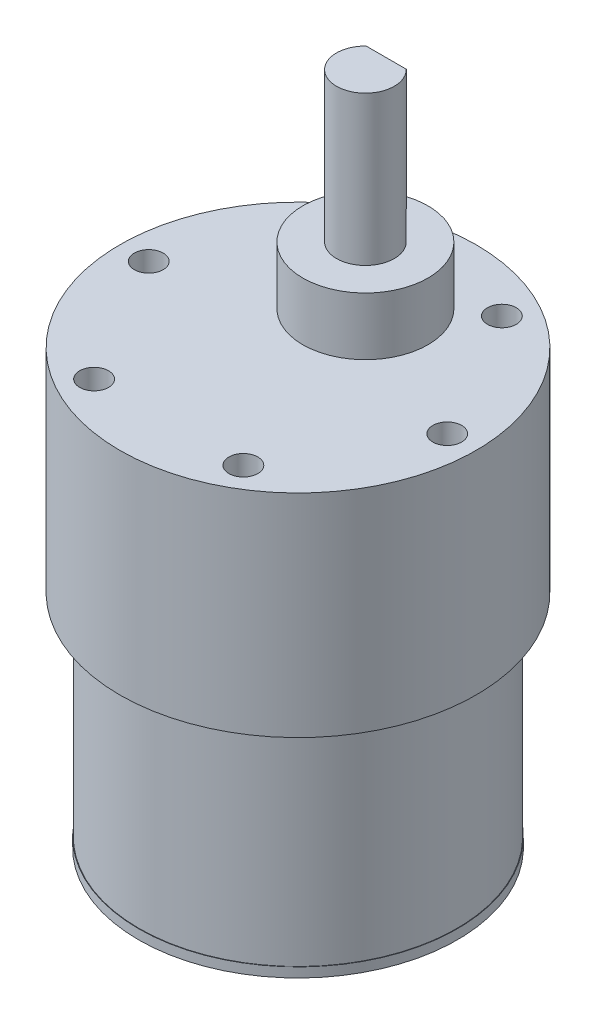
from build123d import *

# Parameters (mm, degrees)
SKETCH1_R           = 18.5
BOSS_EXTRUDE1_DEPTH = 22
SKETCH2_R           = 16.5
BOSS_EXTRUDE2_DEPTH = 22
SKETCH3_R           = 16.55
BOSS_EXTRUDE3_DEPTH = 1
SKETCH4_R           = 6.5
BOSS_EXTRUDE4_DEPTH = 6
SKETCH6_R           = 3
BOSS_EXTRUDE5_DEPTH = 15.5
CUT_EXTRUDE1_DEPTH  = 12
SKETCH8_R           = 1.5
CUT_EXTRUDE2_DEPTH  = 10


with BuildPart() as part:
    # Sketch1 → Boss-Extrude1 (new body)
    with BuildSketch(Plane(origin=(0, 0, 0), x_dir=(1, 0, 0), z_dir=(0, 1, 0))):
        with Locations(Location((0, 0, 0), (0, 0, 270))):
            Circle(SKETCH1_R)
    extrude(amount=BOSS_EXTRUDE1_DEPTH)

    # Sketch2 → Boss-Extrude2 (add)
    with BuildSketch(Plane.XZ):
        with Locations(Location((0, 0, 0), (0, 0, 270))):
            Circle(SKETCH2_R)
    extrude(amount=BOSS_EXTRUDE2_DEPTH)

    # Sketch3 → Boss-Extrude3 (add)
    with BuildSketch(Plane.XZ.offset(22)):
        with Locations(Location((0, 0, 0), (0, 0, 270))):
            Circle(SKETCH3_R)
    extrude(amount=BOSS_EXTRUDE3_DEPTH)

    # Sketch4 → Boss-Extrude4 (add)
    with BuildSketch(Plane(origin=(0, 22, 0), x_dir=(1, 0, 0), z_dir=(0, 1, 0))):
        with Locations(Location((0, 7, 0), (0, 0, 270))):
            Circle(SKETCH4_R)
    extrude(amount=BOSS_EXTRUDE4_DEPTH)

    # Sketch6 → Boss-Extrude5 (add)
    with BuildSketch(Plane(origin=(0, 28, 0), x_dir=(1, 0, 0), z_dir=(0, 1, 0))):
        with Locations(Location((0, 7, 0), (0, 0, 270))):
            Circle(SKETCH6_R)
    extrude(amount=BOSS_EXTRUDE5_DEPTH)

    # Sketch7 → Cut-Extrude1 (cut)
    with BuildSketch(Plane(origin=(0, 43.5, 0), x_dir=(1, 0, 0), z_dir=(0, 1, 0))):
        Polygon((-2.084617871, 9.15739851), (2.084617871, 9.15739851), (2.280696351, 9.15739851), (2.280696351, 10.992904137), (-3.0808507, 10.992904137), (-3.0808507, 9.15739851), align=None)
    extrude(amount=-CUT_EXTRUDE1_DEPTH, mode=Mode.SUBTRACT)

    # Sketch8 → Cut-Extrude2 (cut)
    with BuildSketch(Plane(origin=(0, 22, 0), x_dir=(1, 0, 0), z_dir=(0, 1, 0))):
        with Locations(Location((15.5, 0, 0), (0, 0, 270))):
            Circle(SKETCH8_R)
        with Locations(Location((7.75, -13.423393759, 0), (0, 0, 270))):
            Circle(SKETCH8_R)
        with Locations(Location((-7.75, -13.423393759, 0), (0, 0, 270))):
            Circle(SKETCH8_R)
        with Locations(Location((-15.5, 0, 0), (0, 0, 270))):
            Circle(SKETCH8_R)
        with Locations(Location((-7.75, 13.423393759, 0), (0, 0, 270))):
            Circle(SKETCH8_R)
        with Locations(Location((7.75, 13.423393759, 0), (0, 0, 270))):
            Circle(SKETCH8_R)
    extrude(amount=-CUT_EXTRUDE2_DEPTH, mode=Mode.SUBTRACT)


solid = part.part
